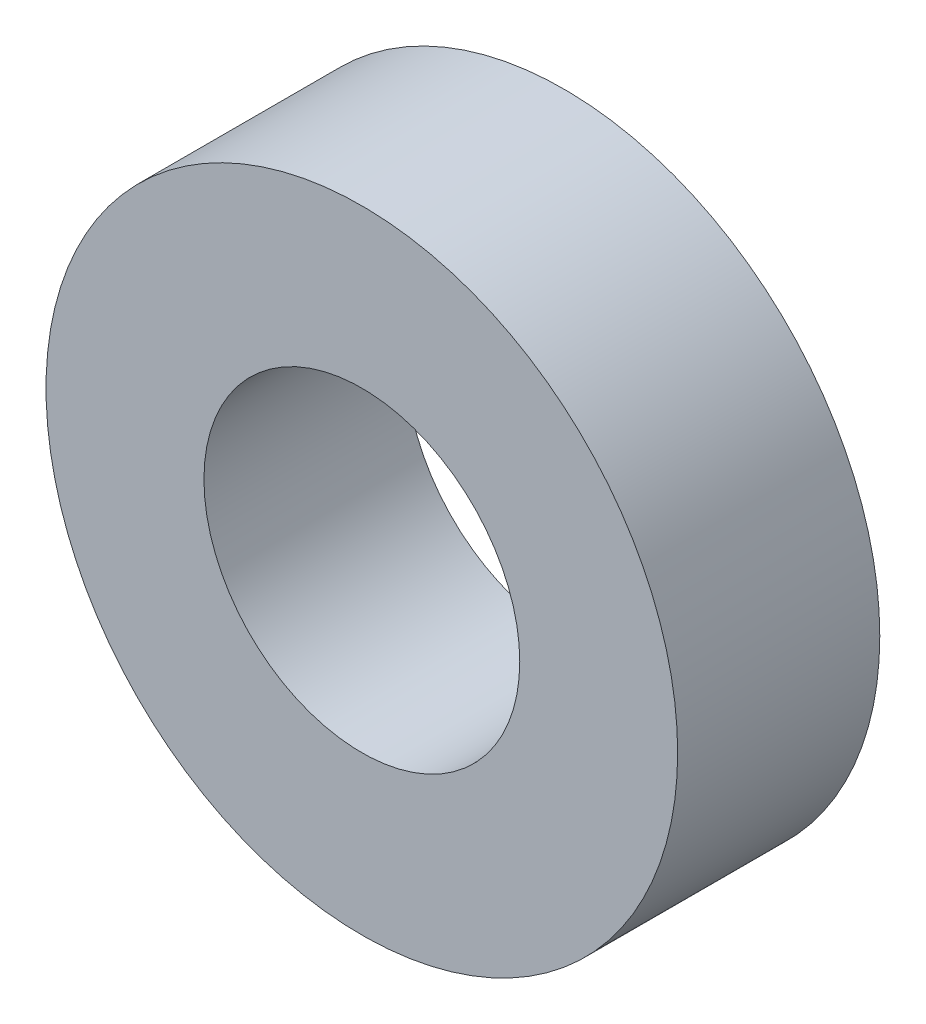
from build123d import *

# Parameters (mm, degrees)
SKETCH1_R      = 25
SKETCH1_R_2    = 12.5
EXTRUDE1_DEPTH = 16


with BuildPart() as part:
    # Sketch1 → Extrude1 (new body)
    with BuildSketch(Plane.XY):
        Circle(SKETCH1_R)
        Circle(SKETCH1_R_2, mode=Mode.SUBTRACT)
    extrude(amount=EXTRUDE1_DEPTH)


solid = part.part
